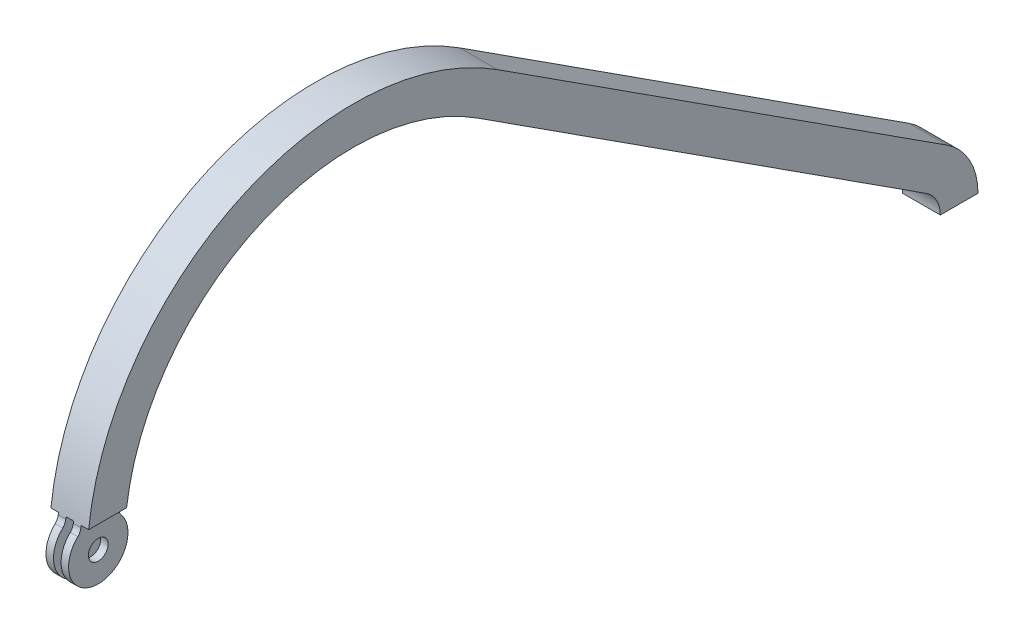
from build123d import *

# Parameters (mm, degrees)
SKETCH3_W           = 38.1
SKETCH3_H           = 38.1
BOSS_EXTRUDE2_DEPTH = 38.1
SKETCH5_R           = 10
CUT_EXTRUDE1_DEPTH  = 967.362983045
SKETCH7_W           = 7.62
SKETCH7_H           = 116.34084036
CUT_EXTRUDE2_DEPTH  = 60


with BuildPart() as part:
    # Sweep1: sweep along a path in Sketch2
    with BuildLine(Plane(origin=(0, 0, 0), x_dir=(0, 0, -1), z_dir=(1, 0, 0))) as sweep1_path:
        ThreePointArc((862.5, 0), (856.407116711, 23.91997287), (839.613395916, 42.010281621))
        Line((839.613395916, 42.010281621), (385.566979579, 335.051408107))
        ThreePointArc((385.566979579, 335.051408107), (130.40013565, 344.535583556), (0, 125))
    # Sketch3 → Sweep1 (sweep)
    with BuildSketch(Plane(origin=(0, 0, 0), x_dir=(1, 0, 0), z_dir=(0, 1, 0))):
        with Locations((0, 862.5)):
            Rectangle(SKETCH3_W, SKETCH3_H)
    sweep(path=sweep1_path.line)

    # Sketch4 → Boss-Extrude2 (add)
    with BuildSketch(Plane(origin=(19.05, 0, 0), x_dir=(0, 0, -1), z_dir=(1, 0, 0))):
        with BuildLine():
            ThreePointArc((22.92164625, 144.354537793), (20.985722139, 147.926611635), (20.630635597, 151.974009223))
            ThreePointArc((20.630635597, 151.974009223), (19.44549754, 138.510140473), (19.05, 125))
            Line((19.05, 125), (10, 125))
            ThreePointArc((10, 125), (0, 115), (-10, 125))
            Line((-10, 125), (-19.05, 125))
            ThreePointArc((-19.05, 125), (-18.685251714, 139.004928115), (-17.591995826, 152.971883559))
            ThreePointArc((-17.591995826, 152.971883559), (-18.567549982, 149.591749406), (-20.65335375, 146.758652966))
            ThreePointArc((-20.65335375, 146.758652966), (-1.652643385, 95.04555509), (22.92164625, 144.354537793))
        make_face()
    extrude(amount=-BOSS_EXTRUDE2_DEPTH)

    # Sketch5 → Cut-Extrude1 (cut, through all)
    with BuildSketch(Plane(origin=(19.05, 0, 0), x_dir=(0, 0, -1), z_dir=(1, 0, 0))):
        with Locations((0, 125)):
            Circle(SKETCH5_R)
    extrude(amount=-CUT_EXTRUDE1_DEPTH, mode=Mode.SUBTRACT)

    # Sketch7 → Cut-Extrude2 (cut)
    with BuildSketch(Plane(origin=(0, 95, 0), x_dir=(-1, 0, 0), z_dir=(0, -1, 0))):
        with Locations((-15.24, -0.743263463)):
            Rectangle(SKETCH7_W, SKETCH7_H)
        with Locations((0, -0.743263463)):
            Rectangle(SKETCH7_W, SKETCH7_H)
        with Locations((15.24, -0.743263463)):
            Rectangle(SKETCH7_W, SKETCH7_H)
    extrude(amount=-CUT_EXTRUDE2_DEPTH, mode=Mode.SUBTRACT)


solid = part.part
